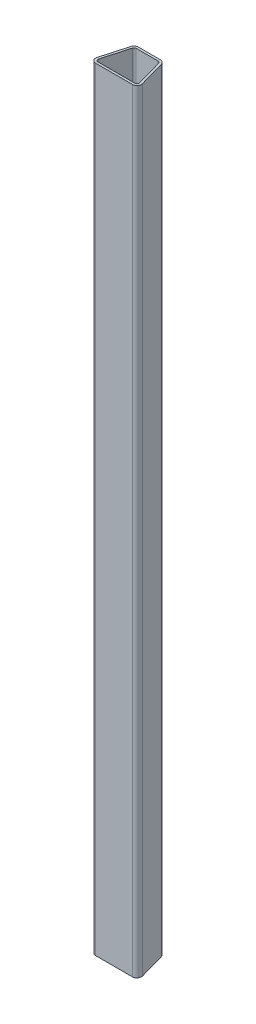
from build123d import *

# Parameters (mm, degrees)
BOSS_EXTRUDE1_DEPTH = 350


with BuildPart() as part:
    # Sketch1 → Boss-Extrude1 (new body)
    with BuildSketch(Plane(origin=(0, 0, 0), x_dir=(1, 0, 0), z_dir=(0, 1, 0))):
        with BuildLine():
            Line((-8.359903733, -8), (8.359903733, -8))
            ThreePointArc((8.359903733, -8), (9.954109226, -7.207687396), (10.285205613, -5.458508846))
            Line((10.285205613, -5.458508846), (6.910205613, 6.541491154))
            ThreePointArc((6.910205613, 6.541491154), (6.192591129, 7.594205493), (4.984903733, 8))
            Line((4.984903733, 8), (-4.984903733, 8))
            ThreePointArc((-4.984903733, 8), (-6.192591129, 7.594205493), (-6.910205613, 6.541491154))
            Line((-6.910205613, 6.541491154), (-10.285205613, -5.458508846))
            ThreePointArc((-10.285205613, -5.458508846), (-9.954109226, -7.207687396), (-8.359903733, -8))
        make_face()
        with BuildLine():
            Line((-8.359903733, -7), (8.359903733, -7))
            ThreePointArc((8.359903733, -7), (9.157006479, -6.603843698), (9.322554673, -5.729254423))
            Line((9.322554673, -5.729254423), (5.947554673, 6.270745577))
            ThreePointArc((5.947554673, 6.270745577), (5.588747431, 6.797102746), (4.984903733, 7))
            Line((4.984903733, 7), (-4.984903733, 7))
            ThreePointArc((-4.984903733, 7), (-5.588747431, 6.797102746), (-5.947554673, 6.270745577))
            Line((-5.947554673, 6.270745577), (-9.322554673, -5.729254423))
            ThreePointArc((-9.322554673, -5.729254423), (-9.157006479, -6.603843698), (-8.359903733, -7))
        make_face(mode=Mode.SUBTRACT)
    extrude(amount=BOSS_EXTRUDE1_DEPTH)


solid = part.part
